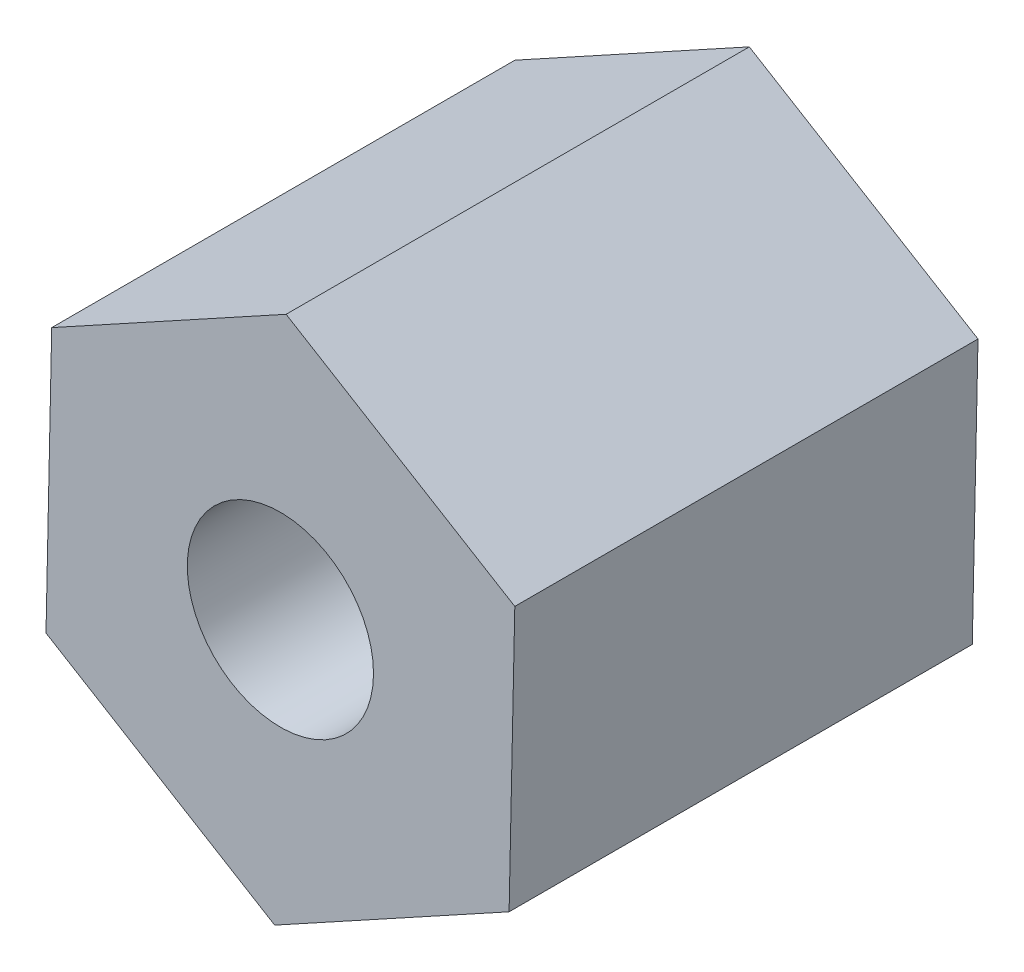
from build123d import *

# Parameters (mm, degrees)
BOSS_EXTRUDE1_DEPTH         = 12.7
TAP_DRILL_FOR_1_4_20_TAP1_D = 5.1054


with BuildPart() as part:
    # Sketch1 → Boss-Extrude1 (new body)
    with BuildSketch(Plane.XY):
        Polygon((6.270235486, -3.800984121), (6.426866551, 3.529691158), (0.156631065, 7.330675279), (-6.270235486, 3.800984121), (-6.426866551, -3.529691158), (-0.156631065, -7.330675279), align=None)
    extrude(amount=BOSS_EXTRUDE1_DEPTH)

    # Tap Drill for 1/4-20 Tap1 (through all)
    with Locations(Plane.XY.offset(12.7)):
        with Locations((0, 0)):
            Hole(TAP_DRILL_FOR_1_4_20_TAP1_D / 2)


solid = part.part
